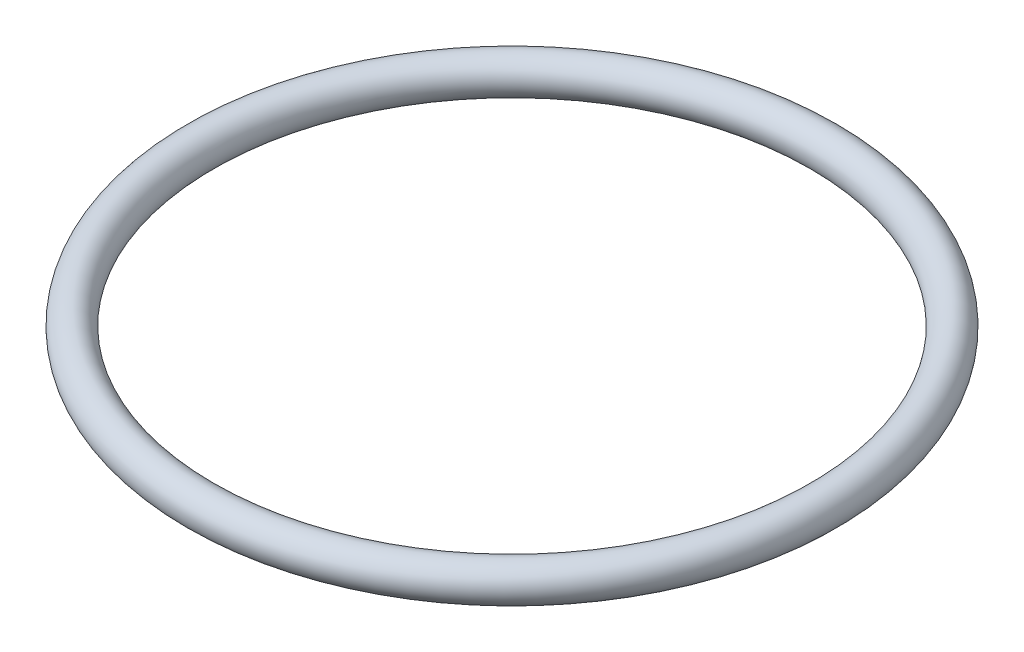
from build123d import *

# Parameters (mm, degrees)
SKETCH_1_R = 1.25


with BuildPart() as part:
    # Эскиз1 → Повернуть1 (revolve)
    with BuildSketch(Plane.XY, mode=Mode.PRIVATE) as revolve_1_sk:
        with Locations((-21.25, 0)):
            Circle(SKETCH_1_R)
    revolve(revolve_1_sk.sketch.rotate(Axis((0, 0, 0), (0, 1, 0)), 270), axis=Axis((0, 0, 0), (0, 1, 0)))


solid = part.part
